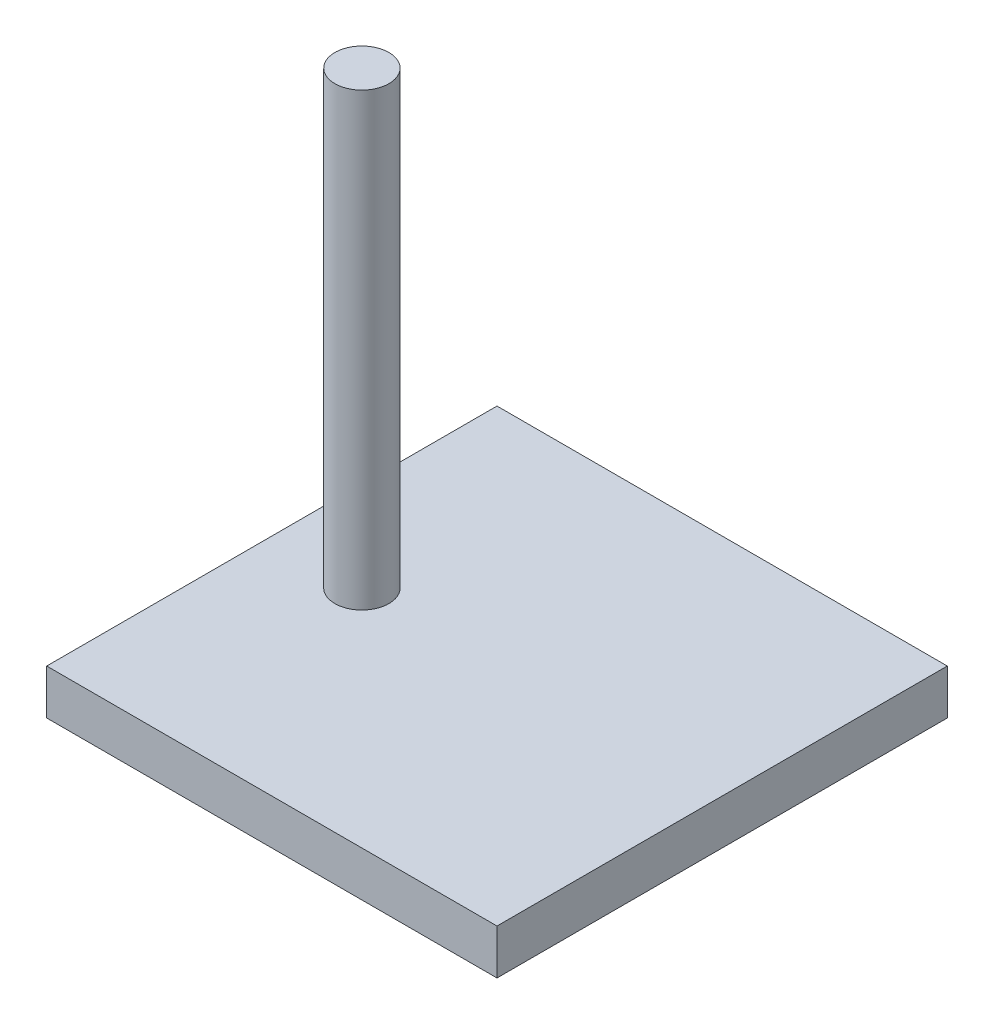
from build123d import *

# Parameters (mm, degrees)
SKETCH1_W           = 100
SKETCH1_H           = 100
BOSS_EXTRUDE1_DEPTH = 10
SKETCH2_R           = 6
BOSS_EXTRUDE2_DEPTH = 100


with BuildPart() as part:
    # Sketch1 → Boss-Extrude1 (new body)
    with BuildSketch(Plane(origin=(0, 0, 0), x_dir=(1, 0, 0), z_dir=(0, 1, 0))):
        Rectangle(SKETCH1_W, SKETCH1_H)
    extrude(amount=BOSS_EXTRUDE1_DEPTH)

    # Sketch2 → Boss-Extrude2 (add)
    with BuildSketch(Plane(origin=(0, 10, 0), x_dir=(1, 0, 0), z_dir=(0, 1, 0))):
        with Locations(Location((-30, 0, 0), (0, 0, 270))):
            Circle(SKETCH2_R)
    extrude(amount=BOSS_EXTRUDE2_DEPTH)


solid = part.part
